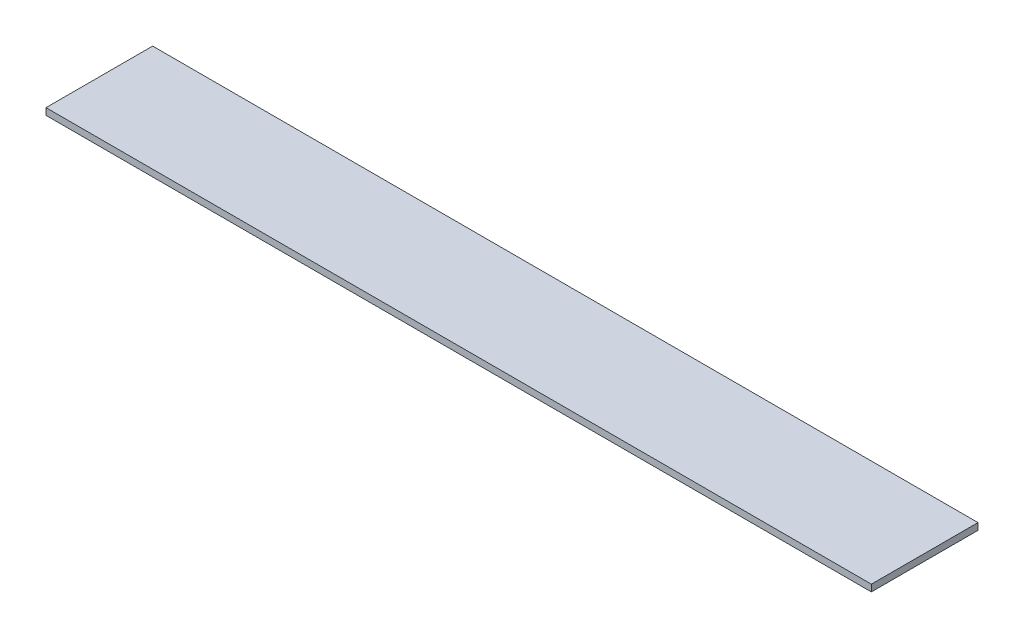
from build123d import *

# Parameters (mm, degrees)
SKETCH1_W           = 311.15
SKETCH1_H           = 40.2
BOSS_EXTRUDE1_DEPTH = 2.54


with BuildPart() as part:
    # Sketch1 → Boss-Extrude1 (new body)
    with BuildSketch(Plane(origin=(0, 0, 0), x_dir=(1, 0, 0), z_dir=(0, 1, 0))):
        with Locations((155.575, 20.1)):
            Rectangle(SKETCH1_W, SKETCH1_H)
    extrude(amount=BOSS_EXTRUDE1_DEPTH)


solid = part.part
